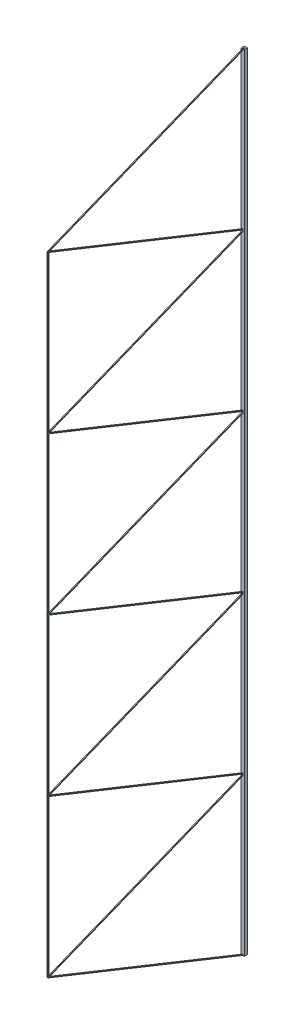
from build123d import *

# Parameters (mm, degrees)
SKETCH150_W                    = 40
SKETCH150_H                    = 40
HW5_SMALLBEAM40_1_DEPTH        = 10000
SKETCH144_W                    = 10
SKETCH144_H                    = 10
HW5_SMALLBEAM10_1_DEPTH        = 2698.369749548
SKETCH144_ON_SEGMENT_2_W       = 10
SKETCH144_ON_SEGMENT_2_H       = 10
HW5_SMALLBEAM10_1_2_DEPTH      = 2006.787345981
SKETCH144_ON_SEGMENT_3_W       = 10
SKETCH144_ON_SEGMENT_3_H       = 10
HW5_SMALLBEAM10_1_3_DEPTH      = 2002
SKETCH144_ON_SEGMENT_4_W       = 10
SKETCH144_ON_SEGMENT_4_H       = 10
HW5_SMALLBEAM10_1_4_DEPTH      = 2002
SKETCH144_ON_SEGMENT_5_W       = 10
SKETCH144_ON_SEGMENT_5_H       = 10
HW5_SMALLBEAM10_1_5_DEPTH      = 2006.787345981
SKETCH144_ON_SEGMENT_6_W       = 10
SKETCH144_ON_SEGMENT_6_H       = 10
HW5_SMALLBEAM10_1_6_DEPTH      = 2698.369749548
SKETCH147_ON_SEGMENT_1_W       = 10
SKETCH147_ON_SEGMENT_1_H       = 10
HW5_SMALLBEAM10_2_DEPTH        = 2711.260073097
SKETCH147_ON_SEGMENT_2_W       = 10
SKETCH147_ON_SEGMENT_2_H       = 10
HW5_SMALLBEAM10_2_2_DEPTH      = 2729.937742627
SKETCH147_ON_SEGMENT_3_W       = 10
SKETCH147_ON_SEGMENT_3_H       = 10
HW5_SMALLBEAM10_2_3_DEPTH      = 2729.937742627
SKETCH147_ON_SEGMENT_4_W       = 10
SKETCH147_ON_SEGMENT_4_H       = 10
HW5_SMALLBEAM10_2_4_DEPTH      = 2729.937742627
SKETCH147_ON_SEGMENT_5_W       = 10
SKETCH147_ON_SEGMENT_5_H       = 10
HW5_SMALLBEAM10_2_5_DEPTH      = 2729.937742627
SKETCH147_ON_SEGMENT_6_W       = 10
SKETCH147_ON_SEGMENT_6_H       = 10
HW5_SMALLBEAM10_2_6_DEPTH      = 2729.937742627
SKETCH147_ON_SEGMENT_7_W       = 10
SKETCH147_ON_SEGMENT_7_H       = 10
HW5_SMALLBEAM10_2_7_DEPTH      = 2729.937742627
HW5_SMALLBEAM10_2_8_DEPTH      = 2692.582403567
HW5_SMALLBEAM10_2_8_DEPTH_BACK = 18.67766953
SKETCH147_W                    = 10
SKETCH147_H                    = 10


with BuildPart() as part:
    # Sketch150 → Hw5 SMALLBEAM40(1) (new body)
    with BuildSketch(Plane.ZX):
        Rectangle(SKETCH150_W, SKETCH150_H)
    extrude(amount=HW5_SMALLBEAM40_1_DEPTH)


with BuildPart() as body_2:
    # Sketch144 → Hw5 SMALLBEAM10(1) (new body)
    with BuildSketch(Plane(origin=(0, 0, 0), x_dir=(0, -0.9284766908852594, 0.3713906763541039), z_dir=(0, 0.3713906763541039, 0.9284766908852594))):
        Rectangle(SKETCH144_W, SKETCH144_H)
    extrude(amount=HW5_SMALLBEAM10_1_DEPTH)

    # Hw5 SMALLBEAM10(1) mitre 1
    split(bisect_by=Plane(origin=(0, 1000, 2500), x_dir=(1, 0, 0), z_dir=(0, -0.82806723, -0.560628809)), keep=Keep.TOP)


with BuildPart() as body_3:
    # Sketch144 on segment 2 (carried to segment 2) → Hw5 SMALLBEAM10_1 2 (new body)
    with BuildSketch(Plane(origin=(0, 994.212654019, 2500), x_dir=(0, 0, 1), z_dir=(0, 1, 0))):
        Rectangle(SKETCH144_ON_SEGMENT_2_W, SKETCH144_ON_SEGMENT_2_H)
    extrude(amount=HW5_SMALLBEAM10_1_2_DEPTH)

    # Hw5 SMALLBEAM10_1 2 mitre 1
    split(bisect_by=Plane(origin=(0, 3000, 2500), x_dir=(1, 0, 0), z_dir=(0, -1, 0)), keep=Keep.TOP)

    # Hw5 SMALLBEAM10_1 2 mitre 2
    split(bisect_by=Plane(origin=(0, 1000, 2500), x_dir=(-1, 0, 0), z_dir=(0, 0.82806723, 0.560628809)), keep=Keep.TOP)


with BuildPart() as body_4:
    # Sketch144 on segment 3 (carried to segment 3) → Hw5 SMALLBEAM10_1 3 (new body)
    with BuildSketch(Plane(origin=(0, 2999, 2500), x_dir=(0, 0, 1), z_dir=(0, 1, 0))):
        Rectangle(SKETCH144_ON_SEGMENT_3_W, SKETCH144_ON_SEGMENT_3_H)
    extrude(amount=HW5_SMALLBEAM10_1_3_DEPTH)

    # Hw5 SMALLBEAM10_1 3 mitre 1
    split(bisect_by=Plane(origin=(0, 5000, 2500), x_dir=(1, 0, 0), z_dir=(0, -1, 0)), keep=Keep.TOP)

    # Hw5 SMALLBEAM10_1 3 mitre 2
    split(bisect_by=Plane(origin=(0, 3000, 2500), x_dir=(-1, 0, 0), z_dir=(0, 1, 0)), keep=Keep.TOP)


with BuildPart() as body_5:
    # Sketch144 on segment 4 (carried to segment 4) → Hw5 SMALLBEAM10_1 4 (new body)
    with BuildSketch(Plane(origin=(0, 4999, 2500), x_dir=(0, 0, 1), z_dir=(0, 1, 0))):
        Rectangle(SKETCH144_ON_SEGMENT_4_W, SKETCH144_ON_SEGMENT_4_H)
    extrude(amount=HW5_SMALLBEAM10_1_4_DEPTH)

    # Hw5 SMALLBEAM10_1 4 mitre 1
    split(bisect_by=Plane(origin=(0, 7000, 2500), x_dir=(1, 0, 0), z_dir=(0, -1, 0)), keep=Keep.TOP)

    # Hw5 SMALLBEAM10_1 4 mitre 2
    split(bisect_by=Plane(origin=(0, 5000, 2500), x_dir=(-1, 0, 0), z_dir=(0, 1, 0)), keep=Keep.TOP)


with BuildPart() as body_6:
    # Sketch144 on segment 5 (carried to segment 5) → Hw5 SMALLBEAM10_1 5 (new body)
    with BuildSketch(Plane(origin=(0, 6999, 2500), x_dir=(0, 0, 1), z_dir=(0, 1, 0))):
        Rectangle(SKETCH144_ON_SEGMENT_5_W, SKETCH144_ON_SEGMENT_5_H)
    extrude(amount=HW5_SMALLBEAM10_1_5_DEPTH)

    # Hw5 SMALLBEAM10_1 5 mitre 1
    split(bisect_by=Plane(origin=(0, 9000, 2500), x_dir=(1, 0, 0), z_dir=(0, -0.82806723, 0.560628809)), keep=Keep.TOP)

    # Hw5 SMALLBEAM10_1 5 mitre 2
    split(bisect_by=Plane(origin=(0, 7000, 2500), x_dir=(-1, 0, 0), z_dir=(0, 1, 0)), keep=Keep.TOP)


with BuildPart() as body_7:
    # Sketch144 on segment 6 (carried to segment 6) → Hw5 SMALLBEAM10_1 6 (new body)
    with BuildSketch(Plane(origin=(0, 8997.850633662, 2505.373415846), x_dir=(0, 0.928476691, 0.371390676), z_dir=(0, 0.371390676, -0.928476691))):
        Rectangle(SKETCH144_ON_SEGMENT_6_W, SKETCH144_ON_SEGMENT_6_H)
    extrude(amount=HW5_SMALLBEAM10_1_6_DEPTH)

    # Hw5 SMALLBEAM10_1 6 mitre 1
    split(bisect_by=Plane(origin=(0, 9000, 2500), x_dir=(-1, 0, 0), z_dir=(0, 0.82806723, -0.560628809)), keep=Keep.TOP)


with BuildPart() as body_8:
    # Sketch147 on segment 1 (carried to segment 1) → Hw5 SMALLBEAM10(2) (new body)
    with BuildSketch(Plane(origin=(0, 9000, 2500), x_dir=(0, 0.928476691, -0.371390676), z_dir=(0, -0.371390676, -0.928476691))):
        Rectangle(SKETCH147_ON_SEGMENT_1_W, SKETCH147_ON_SEGMENT_1_H)
    extrude(amount=HW5_SMALLBEAM10_2_DEPTH)

    # Hw5 SMALLBEAM10(2) mitre 1
    split(bisect_by=Plane(origin=(0, 8000, 0), x_dir=(-1, 0, 0), z_dir=(0, 1, 0)), keep=Keep.TOP)


with BuildPart() as body_9:
    # Sketch147 on segment 2 (carried to segment 2) → Hw5 SMALLBEAM10_2 2 (new body)
    with BuildSketch(Plane(origin=(0, 8006.936712319, -17.341780798), x_dir=(0, -0.928476691, -0.371390676), z_dir=(0, -0.371390676, 0.928476691))):
        Rectangle(SKETCH147_ON_SEGMENT_2_W, SKETCH147_ON_SEGMENT_2_H)
    extrude(amount=HW5_SMALLBEAM10_2_2_DEPTH)

    # Hw5 SMALLBEAM10_2 2 mitre 1
    split(bisect_by=Plane.XZ.offset(-8000), keep=Keep.TOP)

    # Hw5 SMALLBEAM10_2 2 mitre 2
    split(bisect_by=Plane(origin=(0, 7000, 2500), x_dir=(-1, 0, 0), z_dir=(0, 1, 0)), keep=Keep.TOP)


with BuildPart() as body_10:
    # Sketch147 on segment 3 (carried to segment 3) → Hw5 SMALLBEAM10_2 3 (new body)
    with BuildSketch(Plane(origin=(0, 7006.936712319, 2517.341780798), x_dir=(0, 0.928476691, -0.371390676), z_dir=(0, -0.371390676, -0.928476691))):
        Rectangle(SKETCH147_ON_SEGMENT_3_W, SKETCH147_ON_SEGMENT_3_H)
    extrude(amount=HW5_SMALLBEAM10_2_3_DEPTH)

    # Hw5 SMALLBEAM10_2 3 mitre 1
    split(bisect_by=Plane(origin=(0, 7000, 2500), x_dir=(1, 0, 0), z_dir=(0, -1, 0)), keep=Keep.TOP)

    # Hw5 SMALLBEAM10_2 3 mitre 2
    split(bisect_by=Plane(origin=(0, 6000, 0), x_dir=(-1, 0, 0), z_dir=(0, 1, 0)), keep=Keep.TOP)


with BuildPart() as body_11:
    # Sketch147 on segment 4 (carried to segment 4) → Hw5 SMALLBEAM10_2 4 (new body)
    with BuildSketch(Plane(origin=(0, 6006.936712319, -17.341780798), x_dir=(0, -0.928476691, -0.371390676), z_dir=(0, -0.371390676, 0.928476691))):
        Rectangle(SKETCH147_ON_SEGMENT_4_W, SKETCH147_ON_SEGMENT_4_H)
    extrude(amount=HW5_SMALLBEAM10_2_4_DEPTH)

    # Hw5 SMALLBEAM10_2 4 mitre 1
    split(bisect_by=Plane.XZ.offset(-6000), keep=Keep.TOP)

    # Hw5 SMALLBEAM10_2 4 mitre 2
    split(bisect_by=Plane(origin=(0, 5000, 2500), x_dir=(-1, 0, 0), z_dir=(0, 1, 0)), keep=Keep.TOP)


with BuildPart() as body_12:
    # Sketch147 on segment 5 (carried to segment 5) → Hw5 SMALLBEAM10_2 5 (new body)
    with BuildSketch(Plane(origin=(0, 5006.936712319, 2517.341780798), x_dir=(0, 0.928476691, -0.371390676), z_dir=(0, -0.371390676, -0.928476691))):
        Rectangle(SKETCH147_ON_SEGMENT_5_W, SKETCH147_ON_SEGMENT_5_H)
    extrude(amount=HW5_SMALLBEAM10_2_5_DEPTH)

    # Hw5 SMALLBEAM10_2 5 mitre 1
    split(bisect_by=Plane(origin=(0, 5000, 2500), x_dir=(1, 0, 0), z_dir=(0, -1, 0)), keep=Keep.TOP)

    # Hw5 SMALLBEAM10_2 5 mitre 2
    split(bisect_by=Plane(origin=(0, 4000, 0), x_dir=(-1, 0, 0), z_dir=(0, 1, 0)), keep=Keep.TOP)


with BuildPart() as body_13:
    # Sketch147 on segment 6 (carried to segment 6) → Hw5 SMALLBEAM10_2 6 (new body)
    with BuildSketch(Plane(origin=(0, 4006.936712319, -17.341780798), x_dir=(0, -0.928476691, -0.371390676), z_dir=(0, -0.371390676, 0.928476691))):
        Rectangle(SKETCH147_ON_SEGMENT_6_W, SKETCH147_ON_SEGMENT_6_H)
    extrude(amount=HW5_SMALLBEAM10_2_6_DEPTH)

    # Hw5 SMALLBEAM10_2 6 mitre 1
    split(bisect_by=Plane.XZ.offset(-4000), keep=Keep.TOP)

    # Hw5 SMALLBEAM10_2 6 mitre 2
    split(bisect_by=Plane(origin=(0, 3000, 2500), x_dir=(-1, 0, 0), z_dir=(0, 1, 0)), keep=Keep.TOP)


with BuildPart() as body_14:
    # Sketch147 on segment 7 (carried to segment 7) → Hw5 SMALLBEAM10_2 7 (new body)
    with BuildSketch(Plane(origin=(0, 3006.936712319, 2517.341780798), x_dir=(0, 0.928476691, -0.371390676), z_dir=(0, -0.371390676, -0.928476691))):
        Rectangle(SKETCH147_ON_SEGMENT_7_W, SKETCH147_ON_SEGMENT_7_H)
    extrude(amount=HW5_SMALLBEAM10_2_7_DEPTH)

    # Hw5 SMALLBEAM10_2 7 mitre 1
    split(bisect_by=Plane(origin=(0, 3000, 2500), x_dir=(1, 0, 0), z_dir=(0, -1, 0)), keep=Keep.TOP)

    # Hw5 SMALLBEAM10_2 7 mitre 2
    split(bisect_by=Plane(origin=(0, 2000, 0), x_dir=(-1, 0, 0), z_dir=(0, 1, 0)), keep=Keep.TOP)


with BuildPart() as body_15:
    # Sketch147 → Hw5 SMALLBEAM10_2 8 (new, two sides: drawn at the far end of the back side and taken through both)
    with BuildSketch(Plane(origin=(0, 2000, 0), x_dir=(0, -0.9284766908852595, -0.37139067635410344), z_dir=(0, -0.37139067635410344, 0.9284766908852595)).offset(-HW5_SMALLBEAM10_2_8_DEPTH_BACK)):
        Rectangle(SKETCH147_W, SKETCH147_H)
    extrude(amount=HW5_SMALLBEAM10_2_8_DEPTH + HW5_SMALLBEAM10_2_8_DEPTH_BACK)

    # Hw5 SMALLBEAM10_2 8 mitre 1
    split(bisect_by=Plane.XZ.offset(-2000), keep=Keep.TOP)


solid = Compound([part.part, body_2.part, body_3.part, body_4.part, body_5.part, body_6.part, body_7.part, body_8.part, body_9.part, body_10.part, body_11.part, body_12.part, body_13.part, body_14.part, body_15.part])
